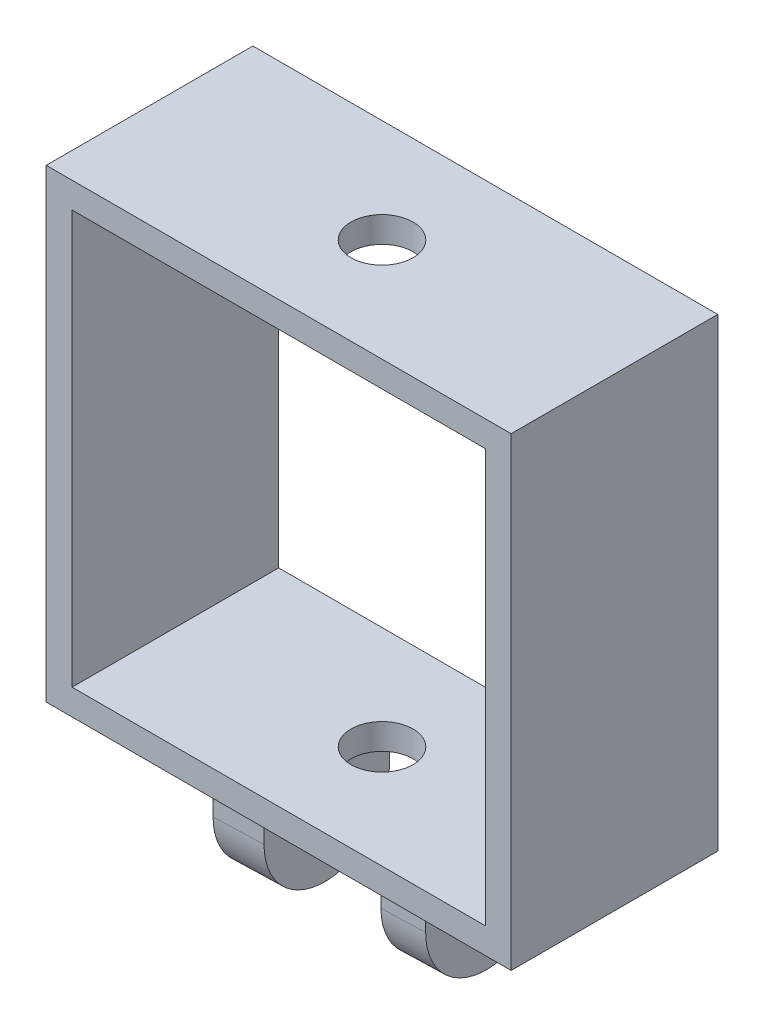
from build123d import *

# Parameters (mm, degrees)
SKETCH_1_W           = 90
SKETCH_1_H           = 90
SKETCH_1_W_2         = 80
SKETCH_1_H_2         = 80
EXTRUDE_1_DEPTH      = 40
SKETCH_3_R           = 6
CUT_EXTRUDE_2_DEPTH  = 109.282039139
EXTRUDE_2_DEPTH      = 20
EXTRUDE_2_DEPTH_BACK = 20
SKETCH_4_R           = 4
SKETCH_5_W           = 22
SKETCH_5_H           = 30
CUT_EXTRUDE_3_DEPTH  = 88.510910897


with BuildPart() as part:
    # 草图1 → 凸台-拉伸1 (new body)
    with BuildSketch(Plane.XY):
        Rectangle(SKETCH_1_W, SKETCH_1_H)
        Rectangle(SKETCH_1_W_2, SKETCH_1_H_2, mode=Mode.SUBTRACT)
    extrude(amount=EXTRUDE_1_DEPTH)

    # 草图3 → 切除-拉伸2 (cut, through all)
    with BuildSketch(Plane(origin=(0, 45, 0), x_dir=(1, 0, 0), z_dir=(0, 1, 0))):
        with Locations((0, -20)):
            Circle(SKETCH_3_R)
    extrude(amount=-CUT_EXTRUDE_2_DEPTH, mode=Mode.SUBTRACT)

    # 草图4 → 凸台-拉伸2 (add, two sides: drawn at the far end of the back side and taken through both)
    with BuildSketch(Plane(origin=(1.596612883, -1.997656421, 74.241754421), x_dir=(-0.029422382723106603, 0, -0.9995670679823816), z_dir=(0.9995670679823816, 0, -0.029422382723106603)).offset(-EXTRUDE_2_DEPTH_BACK)):
        with BuildLine():
            Line((41.765247584, -43.002343579), (41.765247584, -53.002343579))
            ThreePointArc((41.765247584, -53.002343579), (54.265247584, -65.502343579), (66.765247584, -53.002343579))
            Line((66.765247584, -53.002343579), (66.765247584, -43.002343579))
            Line((66.765247584, -43.002343579), (41.765247584, -43.002343579))
        make_face()
        with Locations((54.265247584, -53.002343579)):
            Circle(SKETCH_4_R, mode=Mode.SUBTRACT)
    extrude(amount=EXTRUDE_2_DEPTH + EXTRUDE_2_DEPTH_BACK)

    # 草图5 → 切除-拉伸3 (cut, through all)
    with BuildSketch(Plane(origin=(0.220413113, 0, 7.488098118), x_dir=(-0.9995670679823816, 0, 0.0294223827231066), z_dir=(-0.0294223827231066, 0, -0.9995670679823816))):
        with Locations((0, -60)):
            Rectangle(SKETCH_5_W, SKETCH_5_H)
    extrude(amount=-CUT_EXTRUDE_3_DEPTH, mode=Mode.SUBTRACT)


solid = part.part
